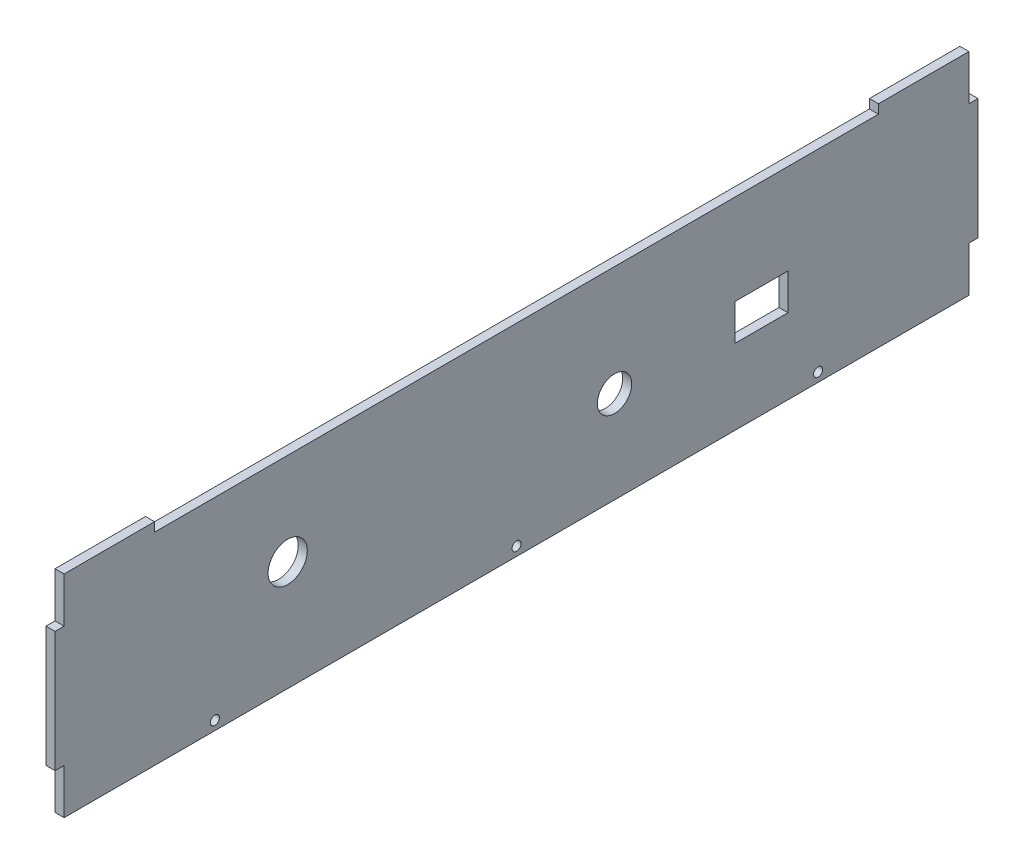
from build123d import *

# Parameters (mm, degrees)
BOSS_EXTRUDE2_DEPTH     = 3
CUT_EXTRUDE1_DEPTH      = 330.393231219
CUT_EXTRUDE1_DEPTH_BACK = 3
SKETCH4_W               = 17.5
SKETCH4_H               = 12
CUT_EXTRUDE2_DEPTH      = 10
SKETCH5_R               = 5.7
CUT_EXTRUDE3_DEPTH      = 10
SKETCH6_R               = 6.5
CUT_EXTRUDE4_DEPTH      = 10
SKETCH7_R               = 1.5
CUT_EXTRUDE5_DEPTH      = 10


with BuildPart() as part:
    # Sketch1 → Boss-Extrude2 (new body)
    with BuildSketch(Plane(origin=(0, 0, 0), x_dir=(0, 0, -1), z_dir=(1, 0, 0))):
        Polygon((18.855403516, 70), (318.855403516, 70), (318.855403516, 55), (321.855403516, 55), (321.855403516, 15), (318.855403516, 15), (318.855403516, 0), (18.855403516, 0), (18.855403516, 15), (15.855403516, 15), (15.855403516, 55), (18.855403516, 55), align=None)
    extrude(amount=BOSS_EXTRUDE2_DEPTH)

    # Sketch3 → Cut-Extrude1 (cut, two sides: drawn at the far end of the back side and taken through both)
    with BuildSketch(Plane(origin=(3, 0, 0), x_dir=(0, 0, -1), z_dir=(1, 0, 0)).offset(-CUT_EXTRUDE1_DEPTH_BACK)):
        Polygon((48.855403516, 643.663019898), (48.855403516, 70), (48.855403516, 67), (288.855403516, 67), (288.855403516, 70), (288.855403516, 643.663019898), (288.855403516, 1790.989059693), (48.855403516, 1790.989059693), align=None)
    extrude(amount=CUT_EXTRUDE1_DEPTH + CUT_EXTRUDE1_DEPTH_BACK, mode=Mode.SUBTRACT)

    # Sketch4 → Cut-Extrude2 (cut)
    with BuildSketch(Plane(origin=(3, 0, 0), x_dir=(0, 0, -1), z_dir=(1, 0, 0))):
        with Locations((250.105403516, 31)):
            Rectangle(SKETCH4_W, SKETCH4_H)
    extrude(amount=-CUT_EXTRUDE2_DEPTH, mode=Mode.SUBTRACT)

    # Sketch5 → Cut-Extrude3 (cut)
    with BuildSketch(Plane(origin=(3, 0, 0), x_dir=(0, 0, -1), z_dir=(1, 0, 0))):
        with Locations((201.355403516, 30.5)):
            Circle(SKETCH5_R)
    extrude(amount=-CUT_EXTRUDE3_DEPTH, mode=Mode.SUBTRACT)

    # Sketch6 → Cut-Extrude4 (cut)
    with BuildSketch(Plane(origin=(3, 0, 0), x_dir=(0, 0, -1), z_dir=(1, 0, 0))):
        with Locations((92.990637001, 36.382151617)):
            Circle(SKETCH6_R)
    extrude(amount=-CUT_EXTRUDE4_DEPTH, mode=Mode.SUBTRACT)

    # Sketch7 → Cut-Extrude5 (cut)
    with BuildSketch(Plane(origin=(3, 0, 0), x_dir=(0, 0, -1), z_dir=(1, 0, 0))):
        with Locations((268.855403516, 3)):
            Circle(SKETCH7_R)
        with Locations((168.855403516, 3)):
            Circle(SKETCH7_R)
        with Locations((68.855403516, 3)):
            Circle(SKETCH7_R)
    extrude(amount=-CUT_EXTRUDE5_DEPTH, mode=Mode.SUBTRACT)


solid = part.part
